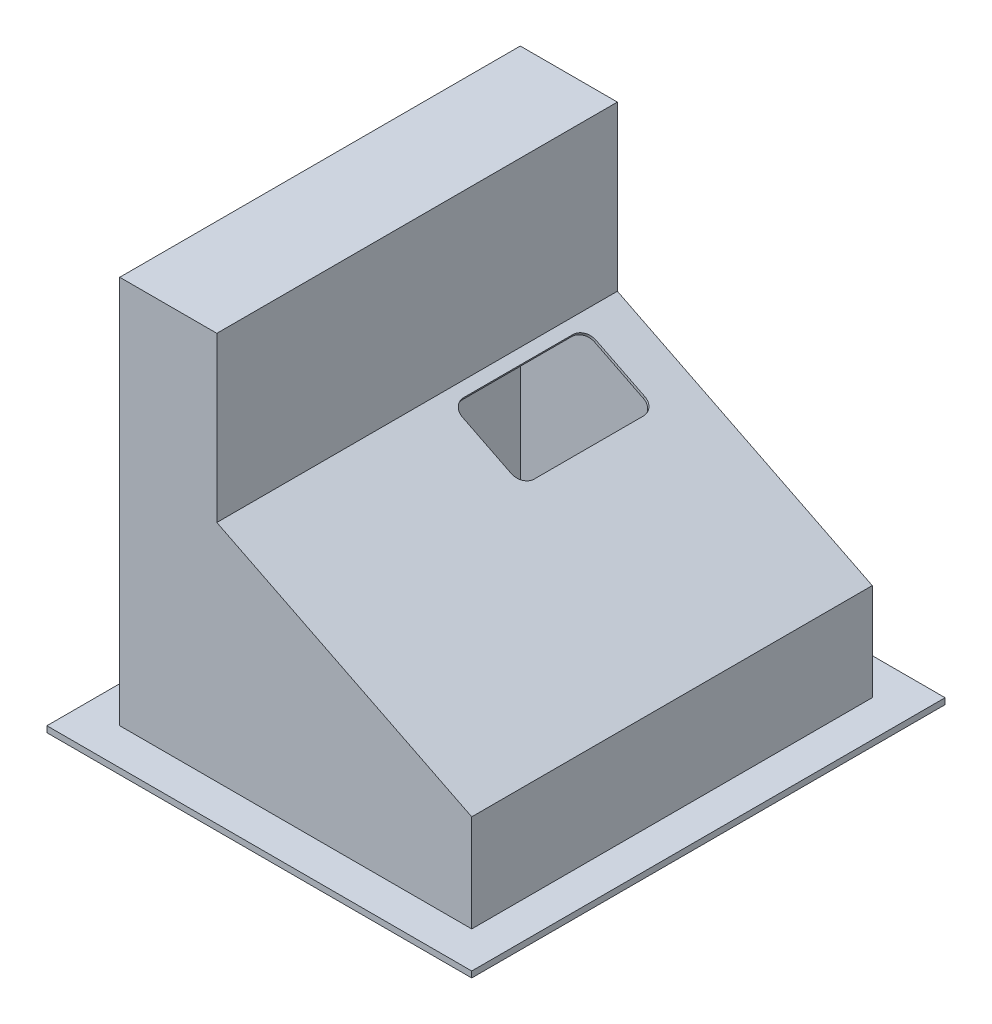
from build123d import *

# Parameters (mm, degrees)
EXTRUDE1_DEPTH     = 101.6
EXTRUDE2_DEPTH     = 1.5875
EXTRUDE3_DEPTH     = 1.5875
SKETCH4_W          = 111.125
SKETCH4_H          = 1.5875
EXTRUDE4_DEPTH     = 9.525
SKETCH5_W          = 111.125
SKETCH5_H          = 1.5875
EXTRUDE5_DEPTH     = 9.525
SKETCH6_W          = 2.431707811
SKETCH6_H          = 101.6
EXTRUDE6_DEPTH     = 25.4
SKETCH8_R          = 2.5
CUT_EXTRUDE1_DEPTH = 1.5875
CUT_EXTRUDE2_DEPTH = 3


with BuildPart() as part:
    # Sketch1 → Extrude1 (new body)
    with BuildSketch(Plane.XY):
        Polygon((101.6, 0), (101.6, 25.4), (34.925, 58.7375), (34.925, 101.6), (9.525, 101.6), (9.525, 0), (0, 0), (0, -1.5875), (11.1125, -1.5875), (11.1125, 100.0125), (33.3375, 100.0125), (33.3375, 58.7375), (100.0125, 25.4), (100.0125, -1.5875), (111.125, -1.5875), (111.125, 0), align=None)
    extrude(amount=EXTRUDE1_DEPTH)

    # Sketch2 → Extrude2 (add)
    with BuildSketch(Plane.XY.offset(101.6)):
        Polygon((0, 0), (9.525, 0), (9.525, 101.6), (34.925, 101.6), (34.925, 58.7375), (101.6, 25.4), (101.6, 0), (111.125, 0), (111.125, -1.5875), (0, -1.5875), align=None)
    extrude(amount=EXTRUDE2_DEPTH)

    # Sketch3 → Extrude3 (add)
    with BuildSketch(Plane(origin=(0, 0, 0), x_dir=(-1, 0, 0), z_dir=(0, 0, -1))):
        Polygon((-111.125, -1.5875), (-111.125, 0), (-101.6, 0), (-101.6, 25.4), (-34.925, 58.7375), (-34.925, 101.6), (-9.525, 101.6), (-9.525, 0), (0, 0), (0, -1.5875), align=None)
    extrude(amount=EXTRUDE3_DEPTH)

    # Sketch4 → Extrude4 (add)
    with BuildSketch(Plane.XY.offset(103.1875)):
        with Locations((55.5625, -0.79375)):
            Rectangle(SKETCH4_W, SKETCH4_H)
    extrude(amount=EXTRUDE4_DEPTH)

    # Sketch5 → Extrude5 (add)
    with BuildSketch(Plane(origin=(0, 0, -1.5875), x_dir=(-1, 0, 0), z_dir=(0, 0, -1))):
        with Locations((-55.5625, -0.79375)):
            Rectangle(SKETCH5_W, SKETCH5_H)
    extrude(amount=EXTRUDE5_DEPTH)

    # Sketch6 → Extrude6 (add)
    with BuildSketch(Plane(origin=(30.1625, 60.325, 0), x_dir=(0.8944271909999159, -0.44721359549995804, 0), z_dir=(-0.44721359549995804, -0.8944271909999159, 0))):
        with Locations((76.878820209, 50.8)):
            Rectangle(SKETCH6_W, SKETCH6_H)
    extrude(amount=EXTRUDE6_DEPTH)

    # Sketch8 → Cut-Extrude1 (cut)
    with BuildSketch(Plane(origin=(69.85, -34.925, 0), x_dir=(0, 0, -1), z_dir=(0.8944271909999159, -0.447213595499958, 0))):
        with Locations(Location((-50.8, 51.635400371, 0), (0, 0, 90))):
            Circle(SKETCH8_R)
    extrude(amount=-CUT_EXTRUDE1_DEPTH, mode=Mode.SUBTRACT)

    # Sketch9 → Cut-Extrude2 (cut)
    with BuildSketch(Plane(origin=(30.48, 60.96, 0), x_dir=(-0.8944271909999159, 0.44721359549995804, 0), z_dir=(0.44721359549995804, 0.8944271909999159, 0))):
        with BuildLine():
            Line((-25.4, 44.45), (-11.1125, 44.45))
            ThreePointArc((-11.1125, 44.45), (-8.86743597, 43.52006403), (-7.9375, 41.275))
            Line((-7.9375, 41.275), (-7.9375, 12.7))
            ThreePointArc((-7.9375, 12.7), (-8.86743597, 10.45493597), (-11.1125, 9.525))
            Line((-11.1125, 9.525), (-25.4, 9.525))
            ThreePointArc((-25.4, 9.525), (-27.64506403, 10.45493597), (-28.575, 12.7))
            Line((-28.575, 12.7), (-28.575, 41.275))
            ThreePointArc((-28.575, 41.275), (-27.64506403, 43.52006403), (-25.4, 44.45))
        make_face()
    extrude(amount=-CUT_EXTRUDE2_DEPTH, mode=Mode.SUBTRACT)


solid = part.part
